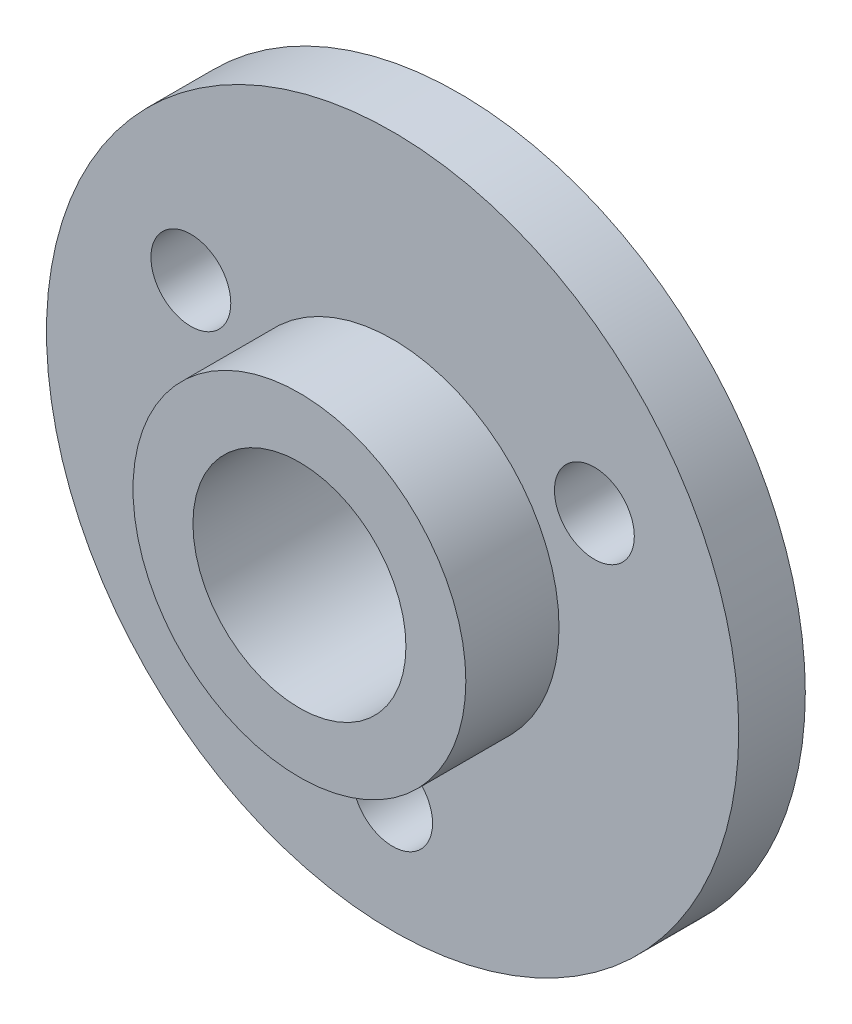
from build123d import *

# Parameters (mm, degrees)
ESBO_O2_R                = 26
ESBO_O2_R_2              = 3
ESBO_O2_R_3              = 8
RESSALTO_EXTRUS_O1_DEPTH = 5
ESBO_O2_4_R              = 12.5
ESBO_O2_4_R_2            = 8
RESSALTO_EXTRUS_O3_DEPTH = 12


with BuildPart() as part:
    # Esboço2 → Ressalto-extrusão1 (new body)
    with BuildSketch(Plane.XY):
        Circle(ESBO_O2_R)
        with Locations((0, -17.5)):
            Circle(ESBO_O2_R_2, mode=Mode.SUBTRACT)
        with Locations((-15.155444566, 8.75)):
            Circle(ESBO_O2_R_2, mode=Mode.SUBTRACT)
        with Locations((15.155444566, 8.75)):
            Circle(ESBO_O2_R_2, mode=Mode.SUBTRACT)
        Circle(ESBO_O2_R_3, mode=Mode.SUBTRACT)
    extrude(amount=RESSALTO_EXTRUS_O1_DEPTH)

    # Esboço2<4> → Ressalto-extrusão3 (add)
    with BuildSketch(Plane.XY):
        Circle(ESBO_O2_4_R)
        Circle(ESBO_O2_4_R_2, mode=Mode.SUBTRACT)
    extrude(amount=RESSALTO_EXTRUS_O3_DEPTH)


solid = part.part
